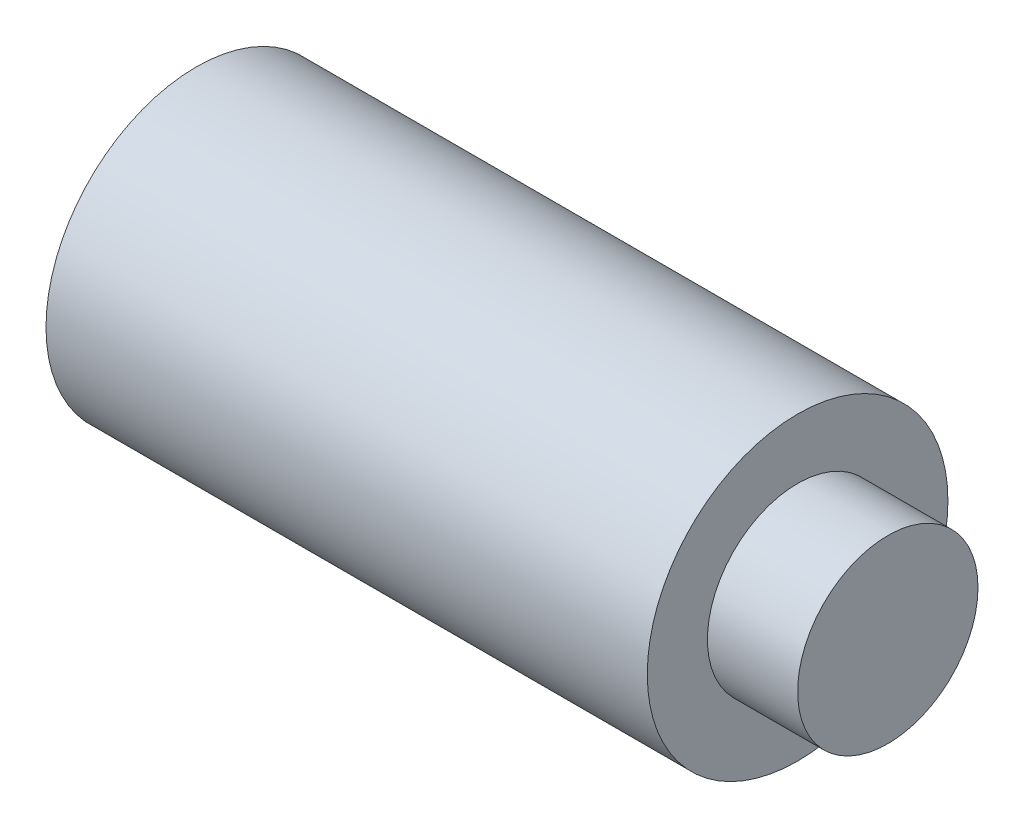
from build123d import *

# Parameters (mm, degrees)
SKETCH_1_R          = 2.5
EXTRUDE_1_DEPTH     = 5
SKETCH_2_R          = 1.5
CUT_EXTRUDE_1_DEPTH = 15
SKETCH_3_R          = 1.5
EXTRUDE_4_DEPTH     = 1.5


with BuildPart() as part:
    # 草图1 → 凸台-拉伸1 (new, symmetric)
    with BuildSketch(Plane(origin=(0, 0, 0), x_dir=(0, 0, -1), z_dir=(1, 0, 0))):
        Circle(SKETCH_1_R)
    extrude(amount=EXTRUDE_1_DEPTH, both=True)

    # 草图2 → 切除-拉伸1 (cut)
    with BuildSketch(Plane(origin=(0, 0, 0), x_dir=(0, 0, -1), z_dir=(1, 0, 0))):
        Circle(SKETCH_2_R)
    extrude(amount=-CUT_EXTRUDE_1_DEPTH, mode=Mode.SUBTRACT)

    # 草图3 → 凸台-拉伸4 (add, symmetric)
    with BuildSketch(Plane(origin=(5, 0, 0), x_dir=(0, 0, -1), z_dir=(1, 0, 0))):
        Circle(SKETCH_3_R)
    extrude(amount=EXTRUDE_4_DEPTH, both=True)


solid = part.part
